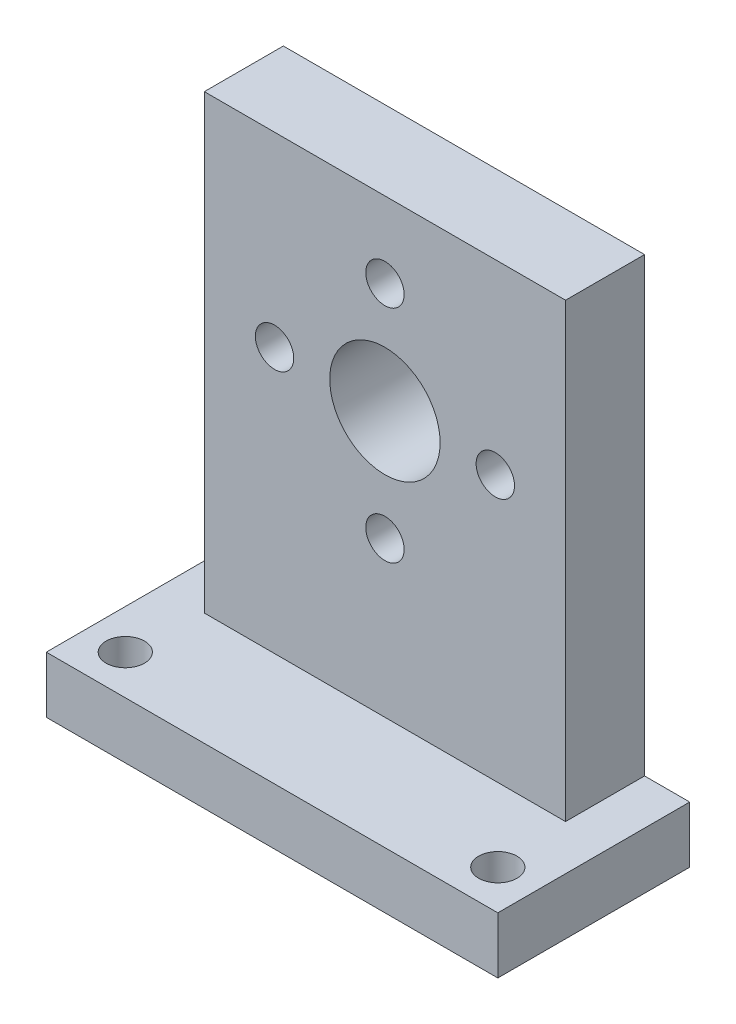
from build123d import *

# Parameters (mm, degrees)
SKETCH1_W           = 40
SKETCH1_H           = 27
SKETCH1_W_2         = 32
SKETCH1_H_2         = 7
BOSS_EXTRUDE1_DEPTH = 5
SKETCH1_3_W         = 32
SKETCH1_3_H         = 7
BOSS_EXTRUDE2_DEPTH = 45
CUT_EXTRUDE1_REACH  = 54.096
SKETCH2_R           = 4.8895
CUT_EXTRUDE2_REACH  = 54.096
SKETCH4_R           = 1.7
CUT_EXTRUDE3_REACH  = 48.715
SKETCH5_R           = 1.7
CUT_EXTRUDE5_REACH  = 48.715
SKETCH7_W           = 40
SKETCH7_H           = 10
SKETCH8_R           = 1.7
CUT_EXTRUDE6_DEPTH  = 6.35


with BuildPart() as part:
    # Sketch1 → Boss-Extrude1 (new body)
    with BuildSketch(Plane(origin=(0, 0, 0), x_dir=(1, 0, 0), z_dir=(0, 1, 0))):
        Rectangle(SKETCH1_W, SKETCH1_H)
        Rectangle(SKETCH1_W_2, SKETCH1_H_2, mode=Mode.SUBTRACT)
    extrude(amount=BOSS_EXTRUDE1_DEPTH)

    # Sketch1<3> → Boss-Extrude2 (add)
    with BuildSketch(Plane(origin=(0, 0, 0), x_dir=(1, 0, 0), z_dir=(0, 1, 0))):
        Rectangle(SKETCH1_3_W, SKETCH1_3_H)
    extrude(amount=BOSS_EXTRUDE2_DEPTH)

    # Sketch2 → Cut-Extrude1 (cut, up to next)
    with BuildSketch(Plane.XY.offset(3.5), mode=Mode.PRIVATE) as cut_extrude1_sk1:
        with Locations((0, 28.5)):
            Circle(SKETCH2_R)
    cut_extrude1_tool1 = extrude(cut_extrude1_sk1.sketch, amount=-CUT_EXTRUDE1_REACH, mode=Mode.PRIVATE) & part.part
    add(cut_extrude1_tool1.solids().sort_by_distance((0, 28.5, 3.5))[0], mode=Mode.SUBTRACT)

    # Sketch4 → Cut-Extrude2 (cut, up to next)
    with BuildSketch(Plane.XY.offset(3.5), mode=Mode.PRIVATE) as cut_extrude2_sk1:
        with Locations((0, 38.279)):
            Circle(SKETCH4_R)
    cut_extrude2_tool1 = extrude(cut_extrude2_sk1.sketch, amount=-CUT_EXTRUDE2_REACH, mode=Mode.PRIVATE) & part.part
    # Sketch4 → Cut-Extrude2 (cut, up to next)
    with BuildSketch(Plane.XY.offset(3.5), mode=Mode.PRIVATE) as cut_extrude2_sk2:
        with Locations((9.779, 28.5)):
            Circle(SKETCH4_R)
    cut_extrude2_tool2 = extrude(cut_extrude2_sk2.sketch, amount=-CUT_EXTRUDE2_REACH, mode=Mode.PRIVATE) & part.part
    # Sketch4 → Cut-Extrude2 (cut, up to next)
    with BuildSketch(Plane.XY.offset(3.5), mode=Mode.PRIVATE) as cut_extrude2_sk3:
        with Locations((0, 18.721)):
            Circle(SKETCH4_R)
    cut_extrude2_tool3 = extrude(cut_extrude2_sk3.sketch, amount=-CUT_EXTRUDE2_REACH, mode=Mode.PRIVATE) & part.part
    # Sketch4 → Cut-Extrude2 (cut, up to next)
    with BuildSketch(Plane.XY.offset(3.5), mode=Mode.PRIVATE) as cut_extrude2_sk4:
        with Locations((-9.779, 28.5)):
            Circle(SKETCH4_R)
    cut_extrude2_tool4 = extrude(cut_extrude2_sk4.sketch, amount=-CUT_EXTRUDE2_REACH, mode=Mode.PRIVATE) & part.part
    add(cut_extrude2_tool1.solids().sort_by_distance((0, 38.279, 3.5))[0], mode=Mode.SUBTRACT)
    add(cut_extrude2_tool2.solids().sort_by_distance((9.779, 28.5, 3.5))[0], mode=Mode.SUBTRACT)
    add(cut_extrude2_tool3.solids().sort_by_distance((0, 18.721, 3.5))[0], mode=Mode.SUBTRACT)
    add(cut_extrude2_tool4.solids().sort_by_distance((-9.779, 28.5, 3.5))[0], mode=Mode.SUBTRACT)

    # Sketch5 → Cut-Extrude3 (cut, up to next)
    with BuildSketch(Plane(origin=(0, 5, 0), x_dir=(1, 0, 0), z_dir=(0, 1, 0)), mode=Mode.PRIVATE) as cut_extrude3_sk1:
        with Locations((-16.5, 10)):
            Circle(SKETCH5_R)
    cut_extrude3_tool1 = extrude(cut_extrude3_sk1.sketch, amount=-CUT_EXTRUDE3_REACH, mode=Mode.PRIVATE) & part.part
    # Sketch5 → Cut-Extrude3 (cut, up to next)
    with BuildSketch(Plane(origin=(0, 5, 0), x_dir=(1, 0, 0), z_dir=(0, 1, 0)), mode=Mode.PRIVATE) as cut_extrude3_sk2:
        with Locations((-16.5, -10)):
            Circle(SKETCH5_R)
    cut_extrude3_tool2 = extrude(cut_extrude3_sk2.sketch, amount=-CUT_EXTRUDE3_REACH, mode=Mode.PRIVATE) & part.part
    # Sketch5 → Cut-Extrude3 (cut, up to next)
    with BuildSketch(Plane(origin=(0, 5, 0), x_dir=(1, 0, 0), z_dir=(0, 1, 0)), mode=Mode.PRIVATE) as cut_extrude3_sk3:
        with Locations((16.5, -10)):
            Circle(SKETCH5_R)
    cut_extrude3_tool3 = extrude(cut_extrude3_sk3.sketch, amount=-CUT_EXTRUDE3_REACH, mode=Mode.PRIVATE) & part.part
    # Sketch5 → Cut-Extrude3 (cut, up to next)
    with BuildSketch(Plane(origin=(0, 5, 0), x_dir=(1, 0, 0), z_dir=(0, 1, 0)), mode=Mode.PRIVATE) as cut_extrude3_sk4:
        with Locations((16.5, 10)):
            Circle(SKETCH5_R)
    cut_extrude3_tool4 = extrude(cut_extrude3_sk4.sketch, amount=-CUT_EXTRUDE3_REACH, mode=Mode.PRIVATE) & part.part
    add(cut_extrude3_tool1.solids().sort_by_distance((-16.5, 5, -10))[0], mode=Mode.SUBTRACT)
    add(cut_extrude3_tool2.solids().sort_by_distance((-16.5, 5, 10))[0], mode=Mode.SUBTRACT)
    add(cut_extrude3_tool3.solids().sort_by_distance((16.5, 5, 10))[0], mode=Mode.SUBTRACT)
    add(cut_extrude3_tool4.solids().sort_by_distance((16.5, 5, -10))[0], mode=Mode.SUBTRACT)

    # Sketch7 → Cut-Extrude5 (cut, up to next)
    with BuildSketch(Plane(origin=(0, 5, 0), x_dir=(1, 0, 0), z_dir=(0, 1, 0)), mode=Mode.PRIVATE) as cut_extrude5_sk1:
        with Locations((0, 8.5)):
            Rectangle(SKETCH7_W, SKETCH7_H)
    cut_extrude5_tool1 = extrude(cut_extrude5_sk1.sketch, amount=-CUT_EXTRUDE5_REACH, mode=Mode.PRIVATE) & part.part
    add(cut_extrude5_tool1.solids().sort_by_distance((0, 5, -8.5))[0], mode=Mode.SUBTRACT)

    # Sketch8 → Cut-Extrude6 (cut)
    with BuildSketch(Plane(origin=(0, 0, -3.5), x_dir=(-1, 0, 0), z_dir=(0, 0, -1))):
        with Locations((-9.779, 2.5)):
            Circle(SKETCH8_R)
        with Locations((9.779, 2.5)):
            Circle(SKETCH8_R)
    extrude(amount=-CUT_EXTRUDE6_DEPTH, mode=Mode.SUBTRACT)


solid = part.part
